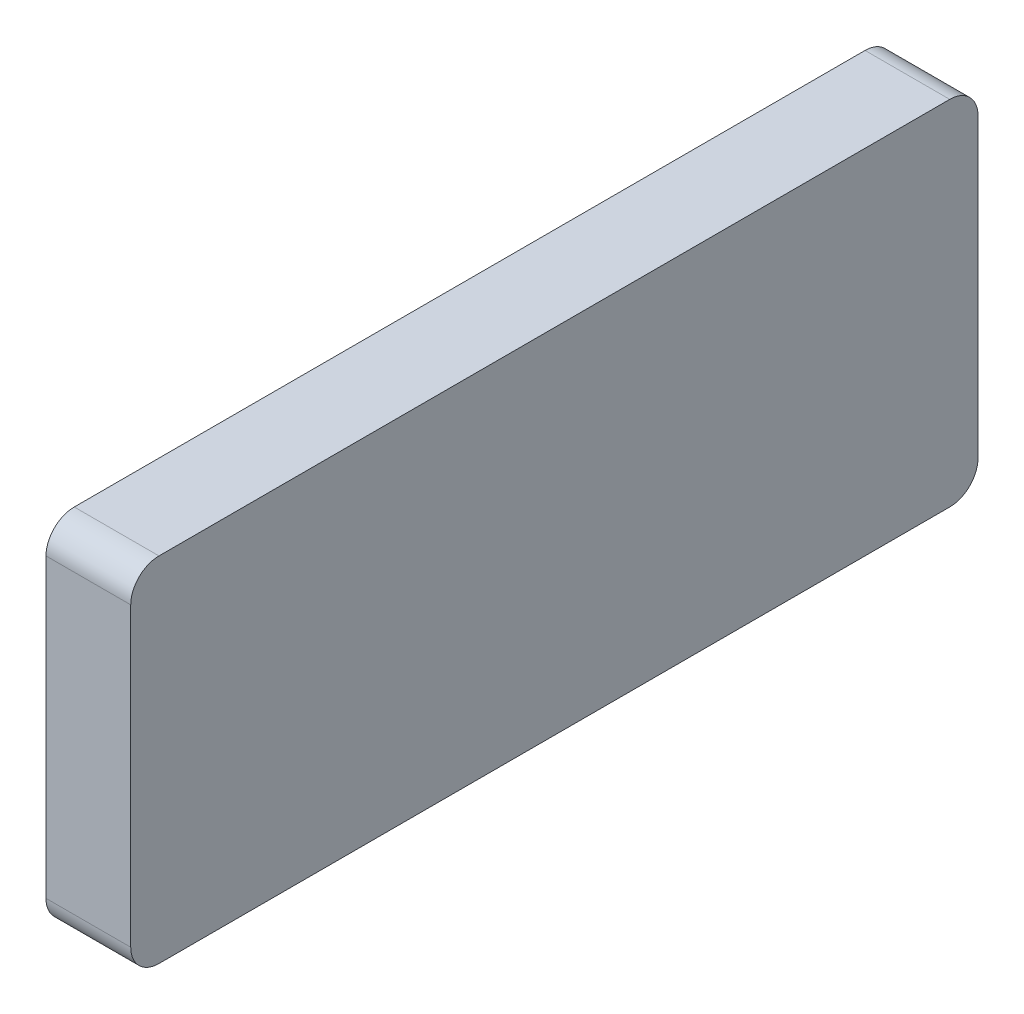
from build123d import *

# Parameters (mm, degrees)
SKETCH1_W           = 60
SKETCH1_H           = 25
BOSS_EXTRUDE1_DEPTH = 6
FILLET1_R           = 2


with BuildPart() as part:
    # Sketch1 → Boss-Extrude1 (new body)
    with BuildSketch(Plane(origin=(0, 0, 0), x_dir=(0, 0, -1), z_dir=(1, 0, 0))):
        with Locations((30, 12.5)):
            Rectangle(SKETCH1_W, SKETCH1_H)
    extrude(amount=BOSS_EXTRUDE1_DEPTH)

    # Fillet1
    fillet1_edges = [part.edges().sort_by_distance(p)[0] for p in [
        (3, 25, 0),
        (3, 25, -60),
        (3, 0, -60),
        (3, 0, 0),
    ]]
    fillet(fillet1_edges, radius=FILLET1_R)


solid = part.part
